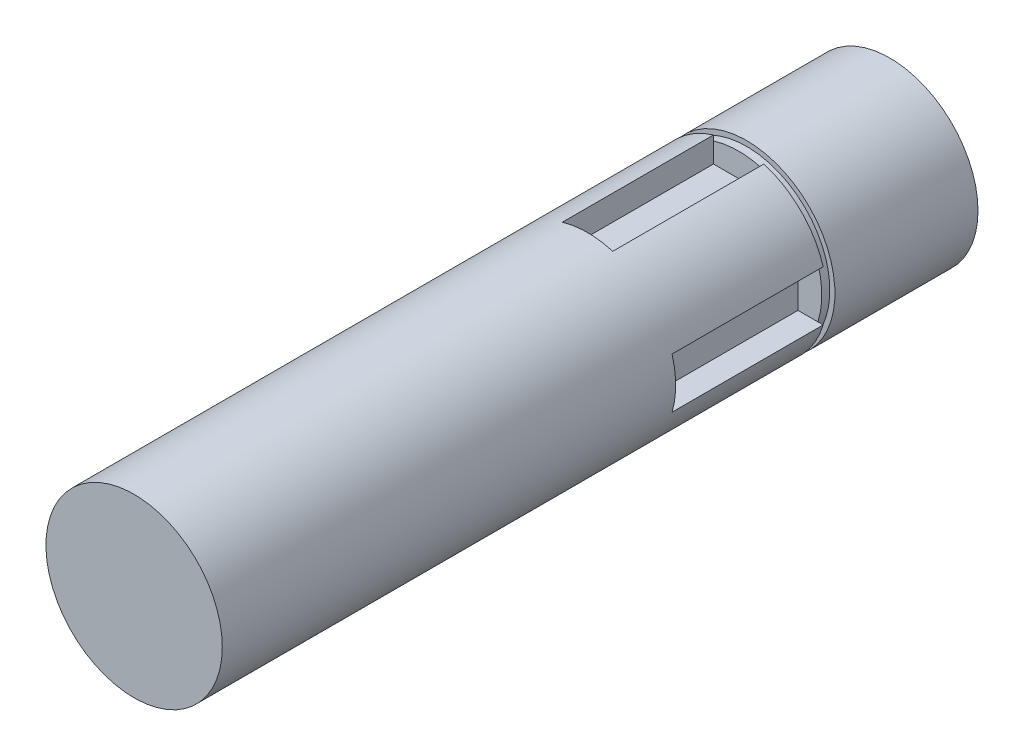
from build123d import *

# Parameters (mm, degrees)
SKETCH1_R           = 17.5
BOSS_EXTRUDE1_DEPTH = 150
CUT_EXTRUDE1_START  = 30
CUT_EXTRUDE1_DEPTH  = 30
SKETCH4_W           = 1.6
SKETCH4_H           = 1


with BuildPart() as part:
    # Sketch1 → Boss-Extrude1 (new body)
    with BuildSketch(Plane.XY):
        Circle(SKETCH1_R)
    extrude(amount=BOSS_EXTRUDE1_DEPTH)

    # Sketch3 → Cut-Extrude1 (cut)
    with BuildSketch(Plane.XY.offset(CUT_EXTRUDE1_START)):
        with BuildLine():
            Line((-5, 16.770509831), (-5, 11.770509831))
            Line((-5, 11.770509831), (5, 11.770509831))
            Line((5, 11.770509831), (5, 16.770509831))
            ThreePointArc((5, 16.770509831), (0, 17.5), (-5, 16.770509831))
        make_face()
        with BuildLine():
            Line((16.770509831, 5), (11.770509831, 5))
            Line((11.770509831, 5), (11.770509831, -5))
            Line((11.770509831, -5), (16.770509831, -5))
            ThreePointArc((16.770509831, -5), (17.5, 0), (16.770509831, 5))
        make_face()
    extrude(amount=CUT_EXTRUDE1_DEPTH, mode=Mode.SUBTRACT)

    # Sketch4 → Cut-Revolve1 (revolve, cut)
    with BuildSketch(Plane(origin=(0, 0, 0), x_dir=(0, 0, -1), z_dir=(1, 0, 0)), mode=Mode.PRIVATE) as cut_revolve1_sk:
        with Locations((-29.2, 17)):
            Rectangle(SKETCH4_W, SKETCH4_H)
    revolve(cut_revolve1_sk.sketch.rotate(Axis((0, 0, 0), (0, 0, 1)), 90), axis=Axis((0, 0, 0), (0, 0, 1)), mode=Mode.SUBTRACT)


solid = part.part
